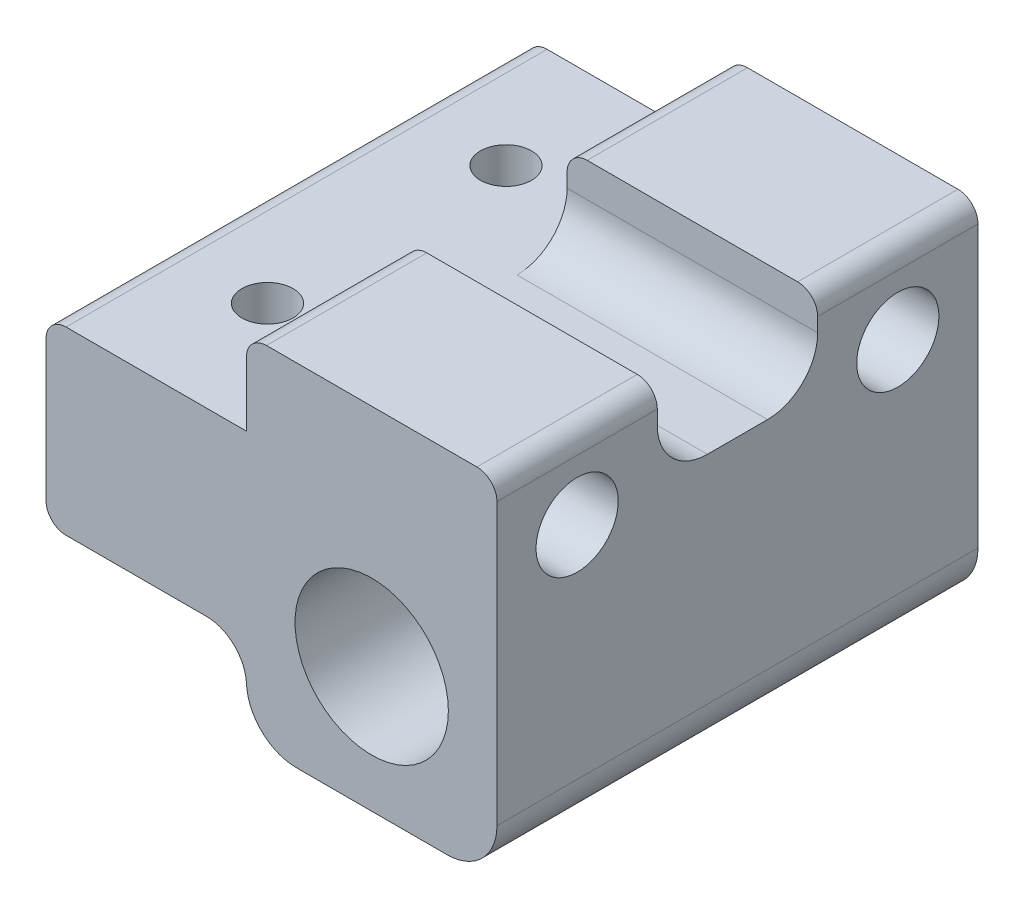
from build123d import *

# Parameters (mm, degrees)
SKETCH_1_W          = 25
SKETCH_1_H          = 48
EXTRUDE_1_DEPTH     = 25
SKETCH_2_R          = 7.65
CUT_EXTRUDE_1_DEPTH = 57.57461336
SKETCH_3_W          = 25
SKETCH_3_H          = 48
EXTRUDE_2_DEPTH     = 10
SKETCH_4_R          = 4.1
CUT_EXTRUDE_2_DEPTH = 53.240311871
FILLET_1_R          = 5
SKETCH_6_W          = 48
SKETCH_6_H          = 18
EXTRUDE_3_DEPTH     = 20
SKETCH_7_R          = 2.55
CUT_EXTRUDE_3_DEPTH = 54.919821703
FILLET_3_R          = 4
SKETCH_8_W          = 25
SKETCH_8_H          = 16
CUT_EXTRUDE_4_DEPTH = 8.406306785
FILLET_4_R          = 5
FILLET_5_R          = 2
FILLET_6_R          = 2


with BuildPart() as part:
    # 草图1 → 凸台-拉伸1 (new body)
    with BuildSketch(Plane(origin=(0, 0, 0), x_dir=(1, 0, 0), z_dir=(0, 1, 0))):
        with Locations((-3.982926829, 5.648780488)):
            Rectangle(SKETCH_1_W, SKETCH_1_H)
    extrude(amount=EXTRUDE_1_DEPTH)

    # 草图2 → 切除-拉伸1 (cut, through all)
    with BuildSketch(Plane.XY.offset(18.351219512)):
        with Locations((-3.982926829, 12.5)):
            Circle(SKETCH_2_R)
    extrude(amount=-CUT_EXTRUDE_1_DEPTH, mode=Mode.SUBTRACT)

    # 草图3 → 凸台-拉伸2 (add)
    with BuildSketch(Plane(origin=(0, 25, 0), x_dir=(1, 0, 0), z_dir=(0, 1, 0))):
        with Locations((-3.982926829, 5.648780488)):
            Rectangle(SKETCH_3_W, SKETCH_3_H)
    extrude(amount=EXTRUDE_2_DEPTH)

    # 草图4 → 切除-拉伸2 (cut, through all)
    with BuildSketch(Plane(origin=(8.517073171, 0, 0), x_dir=(0, 0, -1), z_dir=(1, 0, 0))):
        with Locations((-10.351219512, 27)):
            Circle(SKETCH_4_R)
        with Locations((21.648780488, 27)):
            Circle(SKETCH_4_R)
    extrude(amount=-CUT_EXTRUDE_2_DEPTH, mode=Mode.SUBTRACT)

    # 圆角1
    fillet_1_edges = [part.edges().sort_by_distance(p)[0] for p in [
        (8.517073171, 0, -5.648780488),
        (-16.482926829, 0, -5.648780488),
    ]]
    fillet(fillet_1_edges, radius=FILLET_1_R)

    # 草图6 → 凸台-拉伸3 (add)
    with BuildSketch(Plane.ZY.offset(16.482926829)):
        with Locations((-5.648780488, 17.593693215)):
            Rectangle(SKETCH_6_W, SKETCH_6_H)
    extrude(amount=EXTRUDE_3_DEPTH)

    # 草图7 → 切除-拉伸3 (cut, through all)
    with BuildSketch(Plane.XZ.offset(-8.593693215)):
        with Locations(Location((-26.482926829, 6.251219512, 0), (0, 0, 270))):
            Circle(SKETCH_7_R)
        with Locations(Location((-26.482926829, -17.548780488, 0), (0, 0, 270))):
            Circle(SKETCH_7_R)
    extrude(amount=-CUT_EXTRUDE_3_DEPTH, mode=Mode.SUBTRACT)

    # 圆角3
    fillet_3_edges = [part.edges().sort_by_distance(p)[0] for p in [
        (-16.482926829, 8.593693215, -5.648780488),
    ]]
    fillet(fillet_3_edges, radius=FILLET_3_R)

    # 草图8 → 切除-拉伸4 (cut)
    with BuildSketch(Plane(origin=(0, 35, 0), x_dir=(1, 0, 0), z_dir=(0, 1, 0))):
        with Locations((-3.982926829, 5.648780488)):
            Rectangle(SKETCH_8_W, SKETCH_8_H)
    extrude(amount=-CUT_EXTRUDE_4_DEPTH, mode=Mode.SUBTRACT)

    # 圆角4
    fillet_4_edges = [part.edges().sort_by_distance(p)[0] for p in [
        (-3.982926829, 26.593693215, 2.351219512),
        (-3.982926829, 26.593693215, -13.648780488),
    ]]
    fillet(fillet_4_edges, radius=FILLET_4_R)

    # 圆角5
    fillet_5_edges = [part.edges().sort_by_distance(p)[0] for p in [
        (-36.482926829, 26.593693215, -5.648780488),
        (-36.482926829, 8.593693215, -5.648780488),
    ]]
    fillet(fillet_5_edges, radius=FILLET_5_R)

    # 圆角6
    fillet_6_edges = [part.edges().sort_by_distance(p)[0] for p in [
        (-16.482926829, 35, -21.648780488),
        (8.517073171, 35, 10.351219512),
        (-16.482926829, 35, 10.351219512),
        (8.517073171, 35, -21.648780488),
    ]]
    fillet(fillet_6_edges, radius=FILLET_6_R)


solid = part.part
